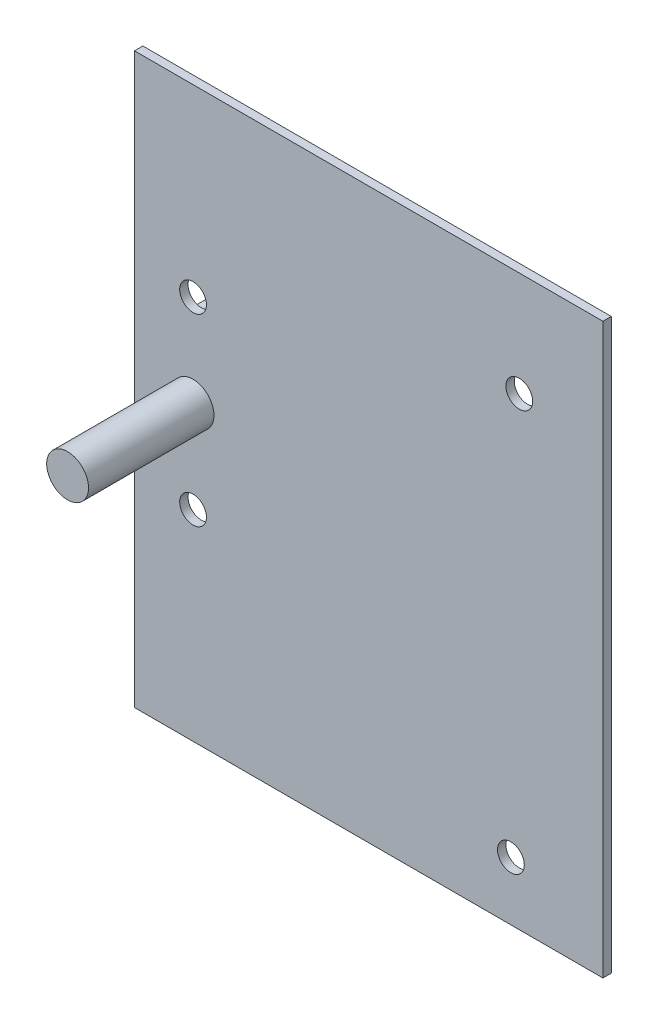
from build123d import *

# Parameters (mm, degrees)
SKETCH_1_W          = 56
SKETCH_1_H          = 68
EXTRUDE_1_DEPTH     = 0.5
SKETCH_2_R          = 2.5
EXTRUDE_2_DEPTH     = 15
SKETCH_3_W          = 6
SKETCH_3_H          = 10
EXTRUDE_3_DEPTH     = 10
SKETCH_4_R          = 1.6
CUT_EXTRUDE_1_DEPTH = 10
SKETCH_5_R          = 1.6
CUT_EXTRUDE_2_DEPTH = 10
SKETCH_6_R          = 1.6
CUT_EXTRUDE_3_DEPTH = 10
SKETCH_7_R          = 1.6
CUT_EXTRUDE_4_DEPTH = 10


with BuildPart() as part:
    # ｽｹｯﾁ1 → ﾎﾞｽ - 押し出し1 (new, symmetric)
    with BuildSketch(Plane.XY):
        with Locations((5, 6)):
            Rectangle(SKETCH_1_W, SKETCH_1_H)
    extrude(amount=EXTRUDE_1_DEPTH, both=True)

    # ｽｹｯﾁ2 → ﾎﾞｽ - 押し出し2 (add)
    with BuildSketch(Plane.XY.offset(0.5)):
        with Locations((-16, 7)):
            Circle(SKETCH_2_R)
    extrude(amount=EXTRUDE_2_DEPTH)

    # ｽｹｯﾁ3 → ﾎﾞｽ - 押し出し3 (add)
    with BuildSketch(Plane(origin=(0, 0, -0.5), x_dir=(-1, 0, 0), z_dir=(0, 0, -1))):
        with Locations((18, 7)):
            Rectangle(SKETCH_3_W, SKETCH_3_H)
    extrude(amount=EXTRUDE_3_DEPTH)

    # ｽｹｯﾁ4 → ｶｯﾄ - 押し出し1 (cut)
    with BuildSketch(Plane(origin=(0, 0, -0.5), x_dir=(-1, 0, 0), z_dir=(0, 0, -1))):
        with Locations((16, -4)):
            Circle(SKETCH_4_R)
    extrude(amount=-CUT_EXTRUDE_1_DEPTH, mode=Mode.SUBTRACT)

    # ｽｹｯﾁ5 → ｶｯﾄ - 押し出し2 (cut)
    with BuildSketch(Plane.XY.offset(0.5)):
        with Locations((-16, 18)):
            Circle(SKETCH_5_R)
    extrude(amount=-CUT_EXTRUDE_2_DEPTH, mode=Mode.SUBTRACT)

    # ｽｹｯﾁ6 → ｶｯﾄ - 押し出し3 (cut)
    with BuildSketch(Plane.XY.offset(0.5)):
        with Locations((23, 27.5)):
            Circle(SKETCH_6_R)
    extrude(amount=-CUT_EXTRUDE_3_DEPTH, mode=Mode.SUBTRACT)

    # ｽｹｯﾁ7 → ｶｯﾄ - 押し出し4 (cut)
    with BuildSketch(Plane.XY.offset(0.5)):
        with Locations((22, -21)):
            Circle(SKETCH_7_R)
    extrude(amount=-CUT_EXTRUDE_4_DEPTH, mode=Mode.SUBTRACT)


solid = part.part
